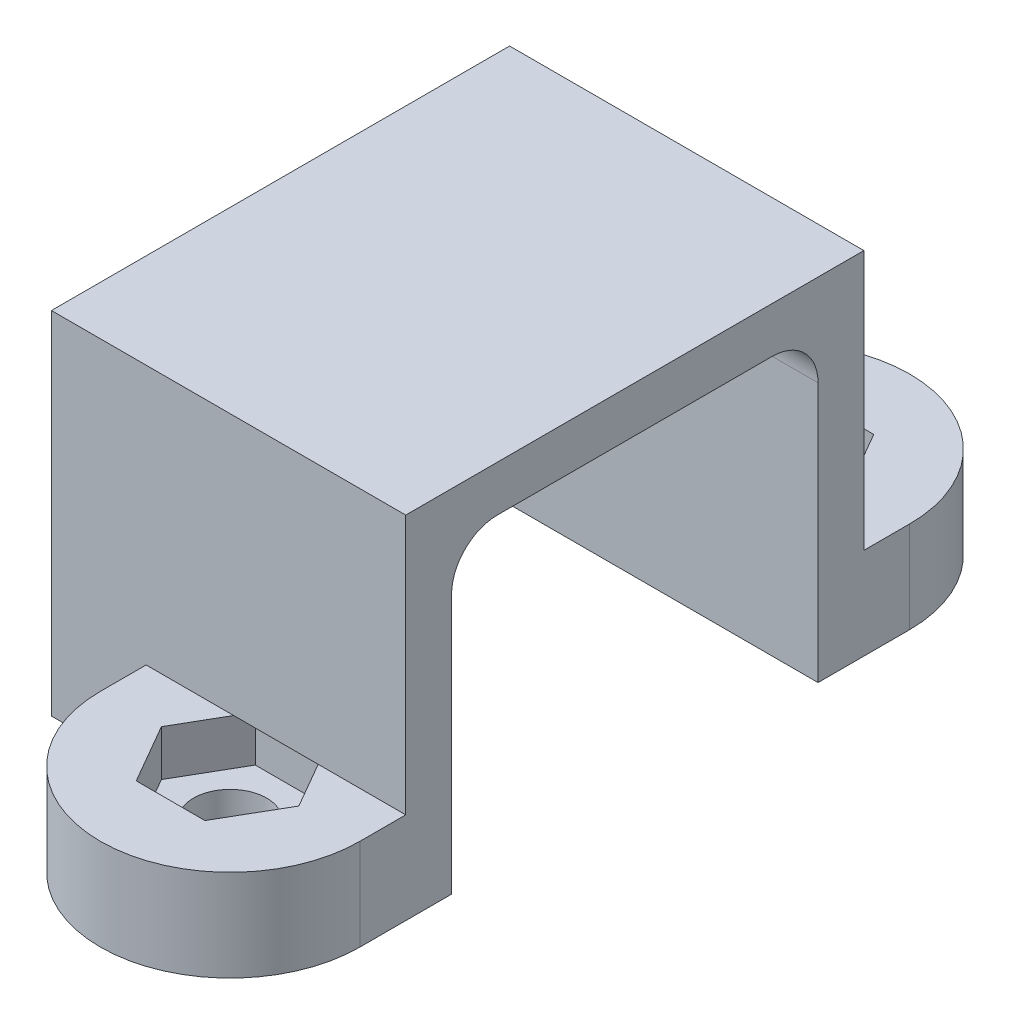
from build123d import *

# Parameters (mm, degrees)
SKETCH1_W                = 11.6
SKETCH1_H                = 15
BODY_DEPTH               = 11.5
FLANGE_DEPTH             = 3
HOLDER_NUT_START         = 3
HOLDER_NUT_DEPTH         = 1.5
HOLE_M2_DEPTH            = 20.021960992
HOLE_M2_DEPTH_BACK       = 20.021960992
SKETCH8_R                = 1.2
FIXTURE_MOTOR_DEPTH      = 20.021960992
FIXTURE_MOTOR_DEPTH_BACK = 20.021960992
GEARBOX_NOTCHES_START    = -9.1
GEARBOX_NOTCHES_DEPTH    = 0.8


with BuildPart() as part:
    # Sketch1 → body (new body)
    with BuildSketch(Plane(origin=(0, 0, 0), x_dir=(1, 0, 0), z_dir=(0, 1, 0))):
        with Locations((-1.55, 0)):
            Rectangle(SKETCH1_W, SKETCH1_H)
    extrude(amount=BODY_DEPTH)

    # Sketch2 → flange (add)
    with BuildSketch(Plane(origin=(0, 0, 0), x_dir=(1, 0, 0), z_dir=(0, 1, 0))):
        with BuildLine():
            Line((-4.25, 9), (-4.25, 7.5))
            Line((-4.25, 7.5), (4.25, 7.5))
            Line((4.25, 7.5), (4.25, 9))
            ThreePointArc((4.25, 9), (0, 13.25), (-4.25, 9))
        make_face()
        with BuildLine():
            Line((4.25, -7.5), (4.25, -9))
            ThreePointArc((4.25, -9), (0, -13.25), (-4.25, -9))
            Line((-4.25, -9), (-4.25, -7.5))
            Line((-4.25, -7.5), (4.25, -7.5))
        make_face()
    extrude(amount=FLANGE_DEPTH)

    # Sketch5 → holder-nut (cut)
    with BuildSketch(Plane(origin=(0, 0, 0), x_dir=(1, 0, 0), z_dir=(0, 1, 0)).offset(HOLDER_NUT_START)):
        Polygon((2.25, 9), (1.125, 10.948557159), (-1.125, 10.948557159), (-2.25, 9), (-1.125, 7.051442841), (1.125, 7.051442841), align=None)
        Polygon((2.25, -9), (1.125, -7.051442841), (-1.125, -7.051442841), (-2.25, -9), (-1.125, -10.948557159), (1.125, -10.948557159), align=None)
    extrude(amount=-HOLDER_NUT_DEPTH, mode=Mode.SUBTRACT)

    # Sketch8 → hole-M2 (cut, two sides: drawn at the far end of the back side and taken through both)
    with BuildSketch(Plane(origin=(0, 0, 0), x_dir=(1, 0, 0), z_dir=(0, 1, 0)).offset(-HOLE_M2_DEPTH_BACK)):
        with Locations(Location((0, 9, 0), (0, 0, 270))):
            Circle(SKETCH8_R)
        with Locations(Location((0, -9, 0), (0, 0, 270))):
            Circle(SKETCH8_R)
    extrude(amount=HOLE_M2_DEPTH + HOLE_M2_DEPTH_BACK, mode=Mode.SUBTRACT)

    # Sketch7 → fixture-motor (cut, two sides: drawn at the far end of the back side and taken through both)
    with BuildSketch(Plane(origin=(0, 0, 0), x_dir=(0, 0, -1), z_dir=(1, 0, 0)).offset(-FIXTURE_MOTOR_DEPTH_BACK)):
        with BuildLine():
            Line((-4.5, 10), (4.5, 10))
            ThreePointArc((4.5, 10), (5.560660172, 9.560660172), (6, 8.5))
            Line((6, 8.5), (6, 0))
            Line((6, 0), (-6, 0))
            Line((-6, 0), (-6, 8.5))
            ThreePointArc((-6, 8.5), (-5.560660172, 9.560660172), (-4.5, 10))
        make_face()
    extrude(amount=FIXTURE_MOTOR_DEPTH + FIXTURE_MOTOR_DEPTH_BACK, mode=Mode.SUBTRACT)

    # Sketch9 → gearbox-notches (cut)
    with BuildSketch(Plane(origin=(4.25, 0, 0), x_dir=(0, 0, -1), z_dir=(1, 0, 0)).offset(GEARBOX_NOTCHES_START)):
        with BuildLine():
            Line((-6, 8.5), (-6, 10))
            Line((-6, 10), (-4.5, 10))
            ThreePointArc((-4.5, 10), (-5.560660172, 9.560660172), (-6, 8.5))
        make_face()
        with BuildLine():
            Line((4.5, 10), (6, 10))
            Line((6, 10), (6, 8.5))
            ThreePointArc((6, 8.5), (5.560660172, 9.560660172), (4.5, 10))
        make_face()
    extrude(amount=GEARBOX_NOTCHES_DEPTH, mode=Mode.SUBTRACT)


solid = part.part
